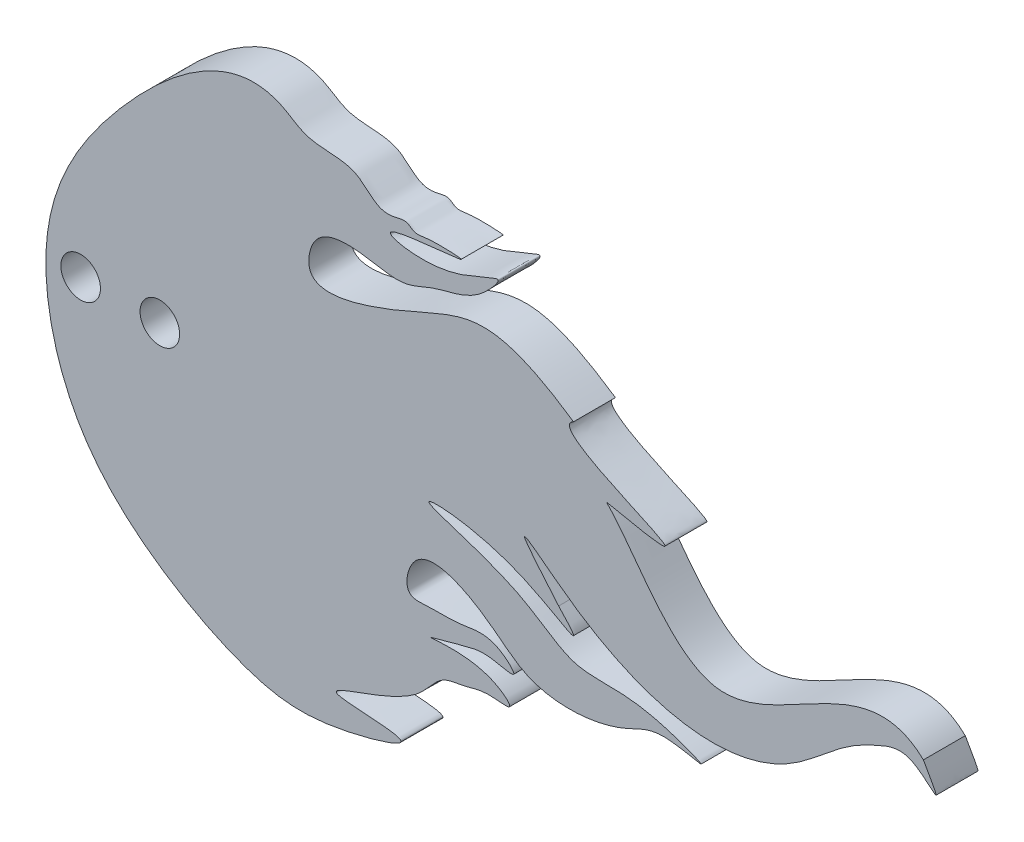
from build123d import *

# Parameters (mm, degrees)
BOSS_EXTRUDE1_DEPTH = 3.175
SKETCH3_R           = 1.5
CUT_EXTRUDE1_DEPTH  = 81.280910153


with BuildPart() as part:
    # Sketch2 → Boss-Extrude1 (new body)
    with BuildSketch(Plane.XY):
        with BuildLine():
            add(Edge.make_bspline(
                [(41.354922008, 31.02302997), (38.547497649, 29.5999623), (56.197448624, 24.351658206), (43.848667642, 27.005328672)],
                knots=[0, 0, 0, 0, 1, 1, 1, 1], degree=3))
            add(Edge.make_bspline(
                [(43.848667642, 27.005328672), (46.003969556, 24.876226154), (52.317391731, 12.233339615), (63.292172969, 26.473388231), (67.873534977, 22.091091155)],
                knots=[0, 0, 0, 0, 0.418790947, 1, 1, 1, 1], degree=3))
            add(Edge.make_bspline(
                [(67.873534977, 22.091091155), (69.952286106, 18.463718024), (67.433162918, 22.494129726), (64.428707381, 21.371911204), (61.496032365, 19.909526677), (55.474919379, 13.766452806), (44.247858944, 15.277469501), (35.356214563, 24.014135277), (40.227086324, 18.367930448)],
                knots=[0, 0, 0, 0, 0.113496662, 0.167732854, 0.228166935, 0.362891971, 0.786599131, 1, 1, 1, 1], degree=3))
            add(Edge.make_bspline(
                [(40.227086324, 18.367930448), (42.971044243, 15.479813332), (37.228800369, 20.192925284), (26.661054296, 20.817727235), (37.140207647, 18.388744125), (41.436557941, 14.391570992), (45.694088503, 15.623701838), (52.985616406, 12.728982809), (47.706349497, 14.240405116), (44.241216456, 11.989814068), (38.31246109, 11.513767973), (34.66300471, 15.242185519), (29.236640561, 17.762203053), (28.419404623, 13.210471391), (30.790308759, 13.449951296), (32.924382125, 13.309666643), (35.105217592, 14.054109544), (37.501199666, 11.793479371), (34.639619564, 12.617761147), (33.215600837, 12.192739251), (28.47354993, 10.955929024), (34.178171302, 12.171320524), (37.184902717, 9.587481414), (34.516397419, 10.091915107), (33.30097735, 9.503411826), (30.982204999, 9.269640924), (29.57443895, 5.948914923), (19.009603941, 3.86886351), (31.070319908, 3.99661371), (22.273677087, 1.38042875), (17.31617436, 1.75354544), (9.704736961, 5.596729633), (2.857103115, 11.846690985), (-0.002403696, 23.759973399), (5.891223125, 34.528565223), (16.039975234, 43.300802724), (21.560052699, 39.097990964), (24.705374408, 39.87396707), (26.391907959, 37.572425744), (27.812968044, 37.633028821), (28.703237606, 37.950783801), (29.262914377, 37.351213006), (30.087045959, 37.492794147), (31.112129967, 37.573180972), (35.231790673, 37.395866137), (23.840142358, 36.836391228), (31.913675915, 35.199447644), (36.718958622, 38.515033863), (33.716356491, 34.973118482), (31.244920113, 34.87432146), (28.380217313, 33.367358419), (25.470552828, 34.158673627), (21.678102843, 34.238774705), (20.769609137, 29.445762123), (32.29778582, 32.356566711), (33.972044054, 36.053078234), (41.354922008, 31.02302997)],
                knots=[0, 0, 0, 0, 0.027351013, 0.057225768, 0.087605747, 0.109238251, 0.134202892, 0.151915928, 0.164943005, 0.176882702, 0.209684683, 0.226359843, 0.250124375, 0.259030142, 0.264876033, 0.27512734, 0.288485991, 0.29476477, 0.301289512, 0.31192611, 0.322200148, 0.342830366, 0.349609356, 0.355756726, 0.36547057, 0.370360401, 0.383662178, 0.412376322, 0.433048898, 0.44979734, 0.482243593, 0.514623274, 0.552538211, 0.601392173, 0.656704679, 0.716728803, 0.724524155, 0.742273371, 0.751842044, 0.756281811, 0.760054029, 0.762807456, 0.765539621, 0.769992504, 0.777854899, 0.800706173, 0.819907406, 0.836431498, 0.844656402, 0.861969845, 0.871044273, 0.884062435, 0.901213434, 0.9103382, 0.931539803, 1, 1, 1, 1], degree=3))
        make_face()
    extrude(amount=BOSS_EXTRUDE1_DEPTH)

    # Sketch3 → Cut-Extrude1 (cut, through all)
    with BuildSketch(Plane.XY.offset(3.175)):
        with Locations((4, 21.838222863)):
            Circle(SKETCH3_R)
        with Locations((10, 21.838222863)):
            Circle(SKETCH3_R)
    extrude(amount=-CUT_EXTRUDE1_DEPTH, mode=Mode.SUBTRACT)


solid = part.part
